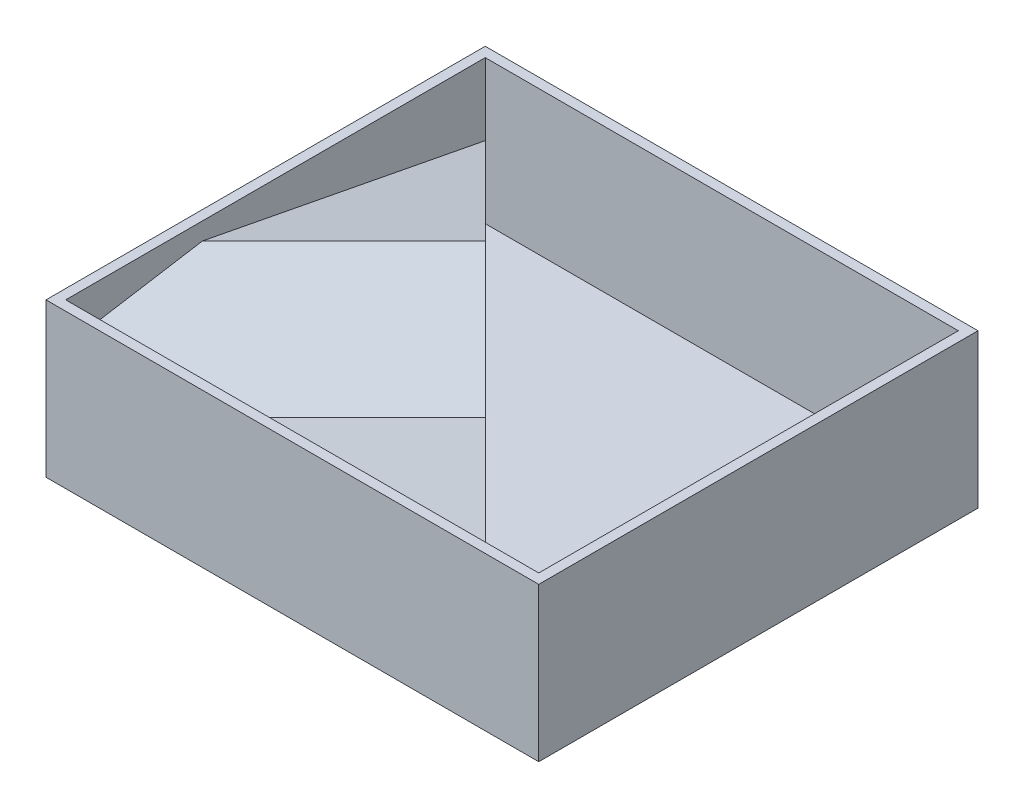
from build123d import *

# Parameters (mm, degrees)
SKETCH1_W                  = 127.078191072
SKETCH1_H                  = 113.282646321
BOSS_EXTRUDE1_DEPTH        = 39.624
SHELL_1_T                  = -2.54
OFFICIAL_RIB_BLOCK20_REACH = 100.208


with BuildPart() as part:
    # Sketch1 → Boss-Extrude1 (new body)
    with BuildSketch(Plane(origin=(0, 0, 0), x_dir=(1, 0, 0), z_dir=(0, 1, 0))):
        with Locations((1.06119575, 7.295720781)):
            Rectangle(SKETCH1_W, SKETCH1_H)
    extrude(amount=BOSS_EXTRUDE1_DEPTH)

    # 抽壳1
    shell_1_openings = [part.faces().sort_by_distance(p)[0] for p in [
        (1.06119575, 39.624, -7.295720782),
    ]]
    offset(amount=SHELL_1_T, openings=shell_1_openings, kind=Kind.INTERSECTION)

    # 草图1 walls → official_rib_block20 (add, up to next)
    with BuildSketch(Plane(origin=(0.729572078, 0, -0.729572078), x_dir=(0.7071067811865477, 0, 0.7071067811865475), z_dir=(-0.7071067811865475, 0, 0.7071067811865477)), mode=Mode.PRIVATE) as official_rib_block20_sk1:
        Polygon((-180.846538696, -7.451602251), (-34.181409887, 32.514624019), (7.60678752, 22.77672703), (210.143173935, 50.617967106), (209.797270961, 53.134303954), (7.726, 25.357), (-34.23, 35.134), (-181.514338156, -5.000960726), align=None)
    official_rib_block20_tool1 = extrude(official_rib_block20_sk1.sketch, amount=OFFICIAL_RIB_BLOCK20_REACH, mode=Mode.PRIVATE) - part.part
    add(official_rib_block20_tool1.solids().sort_by_distance((-8.641006986, 30.2455, -10.100151142))[0])


solid = part.part
